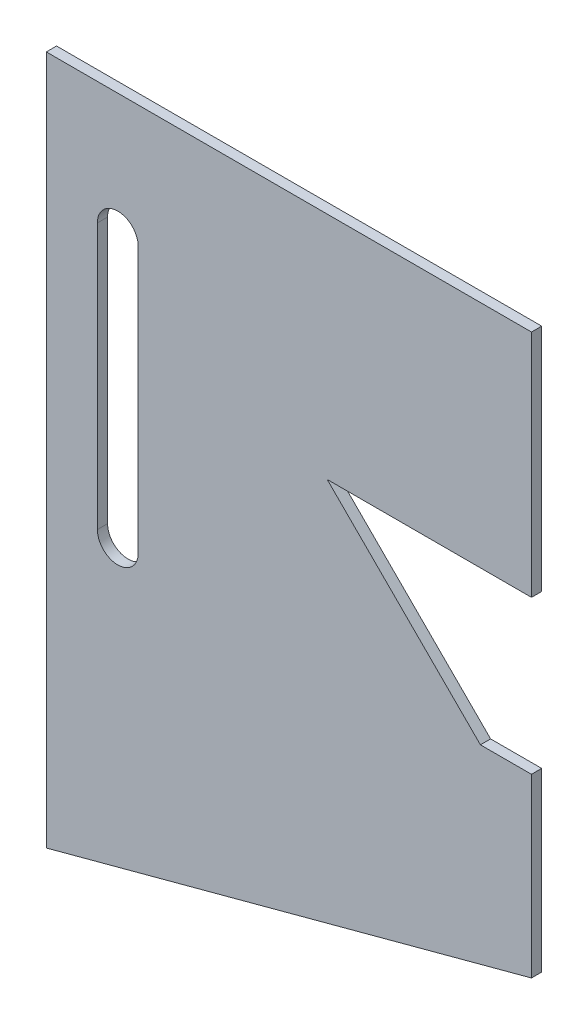
from build123d import *

# Parameters (mm, degrees)
AUFSATZ_LINEAR_AUSTRAGEN1_DEPTH = 2


with BuildPart() as part:
    # Skizze2 → Aufsatz-Linear austragen1 (new body)
    with BuildSketch(Plane.XY):
        Polygon((0, 0), (95, 25.455173281), (95, 60), (85, 60), (55, 90), (95, 90), (95, 135), (0, 135), align=None)
        with BuildLine():
            Line((18, 111), (18, 59))
            ThreePointArc((18, 59), (14, 55), (10, 59))
            Line((10, 59), (10, 111))
            ThreePointArc((10, 111), (14, 115), (18, 111))
        make_face(mode=Mode.SUBTRACT)
    extrude(amount=AUFSATZ_LINEAR_AUSTRAGEN1_DEPTH)


solid = part.part
